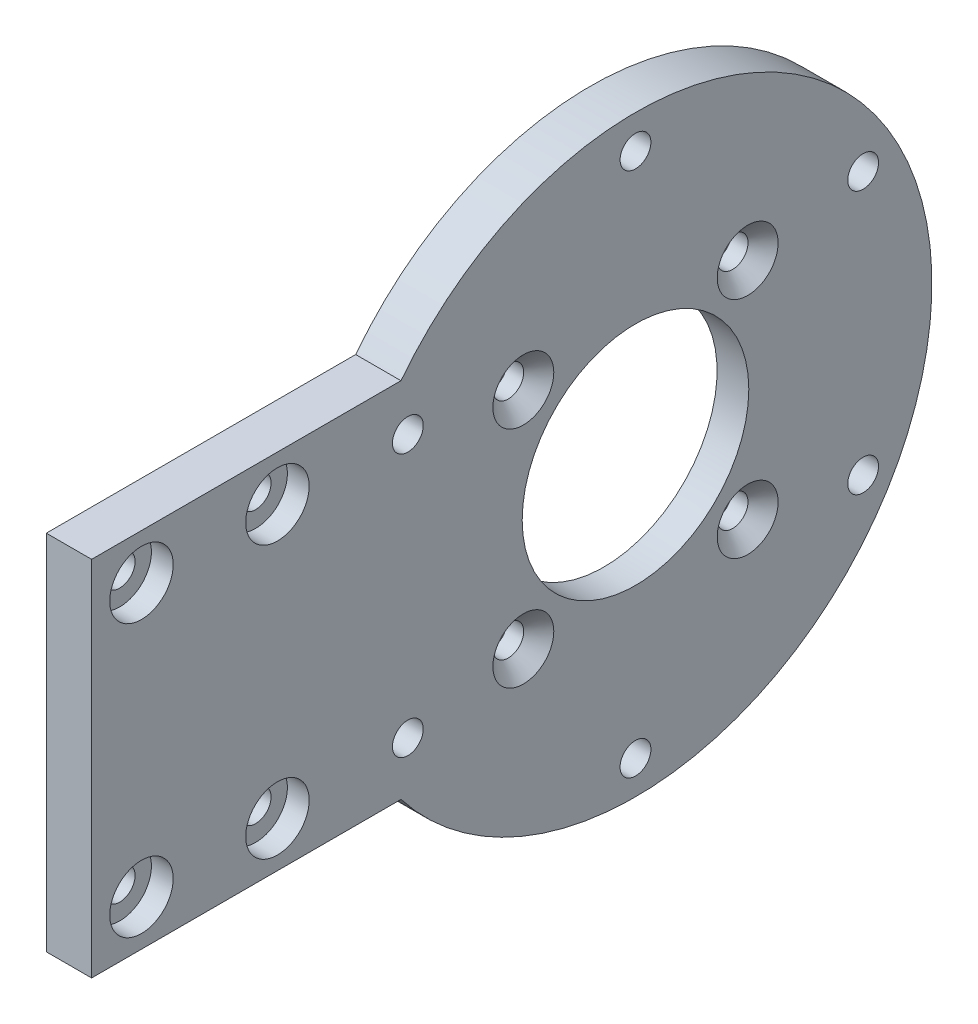
from build123d import *

# Parameters (mm, degrees)
CROQUIS1_R                                           = 12.5
SALIENTE_EXTRUIR1_DEPTH                              = 2.5
CROQUIS2_R                                           = 21
CORTAR_EXTRUIR1_DEPTH                                = 1.5
REFRENTADO_PARA_TORNILLO_TAP_N_CON_CABEZ_D           = 3.4
REFRENTADO_PARA_TORNILLO_TAP_N_CON_CABEZ_DEPTH       = 10
REFRENTADO_PARA_TORNILLO_TAP_N_CON_CABEZ_CSINK_D     = 6.72
REFRENTADO_PARA_TORNILLO_TAP_N_CON_CABEZ_CSINK_ANGLE = 90
REFRENTADO_PARA_TORNILLO_TAP_N_CON_CABEZ_TIP         = 1.021463052
TALADRO_DE_MARGEN_PARA_M31_D                         = 3.4
REFRENTADO_PARA_TORNILLO_CON_CABEZA_TRON_D           = 3.4
REFRENTADO_PARA_TORNILLO_CON_CABEZA_TRON_CBORE_D     = 7
REFRENTADO_PARA_TORNILLO_CON_CABEZA_TRON_CBORE_DEPTH = 2.4


with BuildPart() as part:
    # Croquis1 → Saliente-Extruir1 (new, symmetric)
    with BuildSketch(Plane(origin=(0, 0, 0), x_dir=(0, 0, -1), z_dir=(1, 0, 0))):
        with BuildLine():
            Line((-25.870639729, 20), (-60, 20))
            Line((-60, 20), (-60, -20))
            Line((-60, -20), (-25.870639729, -20))
            ThreePointArc((-25.870639729, -20), (32.7, 0), (-25.870639729, 20))
        make_face()
        Circle(CROQUIS1_R, mode=Mode.SUBTRACT)
    extrude(amount=SALIENTE_EXTRUIR1_DEPTH, both=True)

    # Croquis2 → Cortar-Extruir1 (cut)
    with BuildSketch(Plane.ZY.offset(2.5)):
        Circle(CROQUIS2_R)
    extrude(amount=-CORTAR_EXTRUIR1_DEPTH, mode=Mode.SUBTRACT)

    # Refrentado para tornillo tapón con cabeza plana de clavija de M31
    with Locations(Plane(origin=(2.5, 0, 0), x_dir=(0, 0, -1), z_dir=(1, 0, 0))):
        with Locations((12.374368671, 12.374368671), (-12.374368671, -12.374368671), (-12.374368671, 12.374368671), (12.374368671, -12.374368671)):
            CounterSinkHole(REFRENTADO_PARA_TORNILLO_TAP_N_CON_CABEZ_D / 2, REFRENTADO_PARA_TORNILLO_TAP_N_CON_CABEZ_CSINK_D / 2, depth=REFRENTADO_PARA_TORNILLO_TAP_N_CON_CABEZ_DEPTH, counter_sink_angle=REFRENTADO_PARA_TORNILLO_TAP_N_CON_CABEZ_CSINK_ANGLE)
            with Locations((0, 0, -(REFRENTADO_PARA_TORNILLO_TAP_N_CON_CABEZ_DEPTH + REFRENTADO_PARA_TORNILLO_TAP_N_CON_CABEZ_TIP / 2))):  # 118° drill point
                Cone(0, REFRENTADO_PARA_TORNILLO_TAP_N_CON_CABEZ_D / 2, REFRENTADO_PARA_TORNILLO_TAP_N_CON_CABEZ_TIP, mode=Mode.SUBTRACT)

    # Taladro de margen para M31 (through all)
    with Locations(Plane(origin=(2.5, 0, 0), x_dir=(0, 0, -1), z_dir=(1, 0, 0))):
        with Locations((0, 29), (25.11473671, 14.5), (25.11473671, -14.5), (0, -29), (-25.11473671, -14.5), (-25.11473671, 14.5)):
            Hole(TALADRO_DE_MARGEN_PARA_M31_D / 2)

    # Refrentado para tornillo con cabeza troncocónica de M31 (through all)
    with Locations(Plane(origin=(2.5, 0, 0), x_dir=(0, 0, -1), z_dir=(1, 0, 0))):
        with Locations((-39.5, 15), (-54.5, -15), (-54.5, 15), (-39.5, -15)):
            CounterBoreHole(REFRENTADO_PARA_TORNILLO_CON_CABEZA_TRON_D / 2, REFRENTADO_PARA_TORNILLO_CON_CABEZA_TRON_CBORE_D / 2, REFRENTADO_PARA_TORNILLO_CON_CABEZA_TRON_CBORE_DEPTH)


solid = part.part
